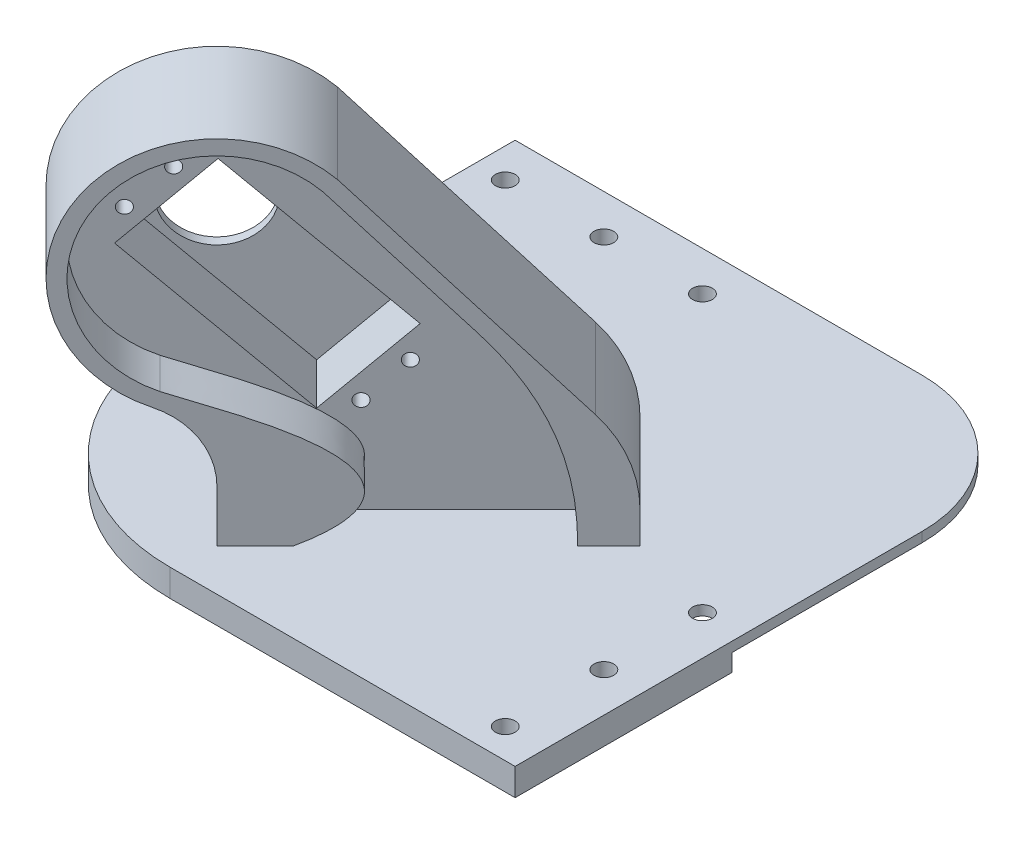
from build123d import *

# Parameters (mm, degrees)
SKETCH2_W                       = 110
SKETCH2_H                       = 110
BOSS_EXTRUDE1_DEPTH             = 5.5
BOSS_EXTRUDE2_DEPTH             = 14
CUT_EXTRUDE5_REACH              = 110.823
SKETCH9_R                       = 1.3
CUT_EXTRUDE6_DEPTH              = 7.5
CUT_EXTRUDE9_REACH              = 109.547
SKETCH11_R                      = 9
BOSS_EXTRUDE7_DEPTH             = 9
BOSS_EXTRUDE7_DIRECTION_2_REACH = 119.904
BOSS_EXTRUDE10_DEPTH            = 9
CUT_EXTRUDE10_DEPTH             = 3.5
F_4_0_4_DIAMETER_HOLE3_D        = 4
FILLET1_R                       = 27.5
FILLET2_R                       = 40


with BuildPart() as part:
    # Sketch2 → Boss-Extrude1 (new body)
    with BuildSketch(Plane(origin=(0, 0, 0), x_dir=(1, 0, 0), z_dir=(0, 1, 0))):
        with Locations((-8.65, 8.65)):
            Rectangle(SKETCH2_W, SKETCH2_H)
    extrude(amount=BOSS_EXTRUDE1_DEPTH)

    # Sketch7 → Boss-Extrude2 (add)
    with BuildSketch(Plane(origin=(-8.65, 0, -8.65), x_dir=(-0.7071067811865479, 0, 0.7071067811865471), z_dir=(-0.7071067811865471, 0, -0.7071067811865479))):
        with BuildLine():
            Line((39.760240188, 5.5), (39.760240188, 15.95953406))
            ThreePointArc((39.760240188, 15.95953406), (42.812638822, 25.987954346), (50.934597235, 32.615181699))
            ThreePointArc((50.934597235, 32.615181699), (60.680796502, 64.420514285), (27.578950135, 67.712223286))
            Line((27.578950135, 67.712223286), (-10.597023433, 29.536249718))
            ThreePointArc((-10.597023433, 29.536249718), (-16.016342216, 21.425665997), (-17.919353903, 11.858580188))
            Line((-17.919353903, 11.858580188), (-17.919353903, 5.5))
            Line((-17.919353903, 5.5), (39.760240188, 5.5))
        make_face()
    extrude(amount=-BOSS_EXTRUDE2_DEPTH)

    # Sketch8 → Cut-Extrude5 (cut, up to next)
    with BuildSketch(Plane(origin=(-7.235786438, 0, -7.235786438), x_dir=(-0.7071067811865479, 0, 0.7071067811865471), z_dir=(-0.7071067811865471, 0, -0.7071067811865479)), mode=Mode.PRIVATE) as cut_extrude5_sk1:
        Polygon((13.613591207, 38.190515171), (42.604969235, 67.1818932), (57.45421164, 52.332650795), (28.462833611, 23.341272767), align=None)
    cut_extrude5_tool1 = extrude(cut_extrude5_sk1.sketch, amount=-CUT_EXTRUDE5_REACH, mode=Mode.PRIVATE) & part.part
    add(cut_extrude5_tool1.solids().sort_by_distance((-32.362049, 45.261583, 17.890476))[0], mode=Mode.SUBTRACT)

    # Sketch9 → Cut-Extrude6 (cut)
    with BuildSketch(Plane(origin=(1.249494937, 0, 1.249494937), x_dir=(0.7071067811865479, 0, -0.7071067811865471), z_dir=(0.7071067811865471, 0, 0.7071067811865479))):
        with Locations((-48.968930266, 65.767679638)):
            Circle(SKETCH9_R)
        with Locations((-56.039998078, 58.696611826)):
            Circle(SKETCH9_R)
        with Locations((-22.098872581, 24.755486329)):
            Circle(SKETCH9_R)
        with Locations((-15.027804769, 31.826554141)):
            Circle(SKETCH9_R)
    extrude(amount=-CUT_EXTRUDE6_DEPTH, mode=Mode.SUBTRACT)

    # Sketch11 → Cut-Extrude9 (cut, up to next)
    with BuildSketch(Plane(origin=(-8.65, 0, -8.65), x_dir=(-0.7071067811865479, 0, 0.7071067811865471), z_dir=(-0.7071067811865471, 0, -0.7071067811865479)), mode=Mode.PRIVATE) as cut_extrude9_sk1:
        with Locations((42.781745931, 52.50942749)):
            Circle(SKETCH11_R)
    cut_extrude9_tool1 = extrude(cut_extrude9_sk1.sketch, amount=-CUT_EXTRUDE9_REACH, mode=Mode.PRIVATE) & part.part
    add(cut_extrude9_tool1.solids().sort_by_distance((-38.901263, 52.509427, 21.601263))[0], mode=Mode.SUBTRACT)

    # Sketch17 → Boss-Extrude7 (add)
    with BuildSketch(Plane(origin=(1.249494937, 0, 1.249494937), x_dir=(0.7071067811865479, 0, -0.7071067811865471), z_dir=(0.7071067811865471, 0, 0.7071067811865479))):
        with BuildLine():
            Line((11.538994713, 28.541175194), (-25.457629791, 69.83354363))
            ThreePointArc((-25.457629791, 69.83354363), (-63.178338442, 66.082526396), (-52.072204394, 29.839240426))
            ThreePointArc((-52.072204394, 29.839240426), (-45.303905717, 24.316550965), (-42.760240188, 15.95953406))
            Line((-42.760240188, 15.95953406), (-42.760240188, 5.5))
            Line((-42.760240188, 5.5), (-39.760240188, 5.5))
            Line((-39.760240188, 5.5), (-39.760240188, 15.95953406))
            ThreePointArc((-39.760240188, 15.95953406), (-42.812638822, 25.987954346), (-50.934597235, 32.615181699))
            ThreePointArc((-50.934597235, 32.615181699), (-60.680796502, 64.420514285), (-27.578950135, 67.712223286))
            Line((-27.578950135, 67.712223286), (9.30583444, 26.537928118))
            ThreePointArc((9.30583444, 26.537928118), (13.46810778, 19.716615191), (14.919353903, 11.858580188))
            Line((14.919353903, 11.858580188), (14.919353903, 5.5))
            Line((14.919353903, 5.5), (17.919353903, 5.5))
            Line((17.919353903, 5.5), (17.919353903, 11.858580188))
            ThreePointArc((17.919353903, 11.858580188), (16.26984662, 20.78911712), (11.538994713, 28.541175194))
        make_face()
    extrude(amount=BOSS_EXTRUDE7_DEPTH)

    # Boss-Extrude7 direction 2: up to this face of the body (flat: up to its plane)
    boss_extrude7_direction_2_end = Plane(part.part.faces().sort_by_distance((-25.67440007, 34.90069961, 8.37440007))[0])
    # Sketch17 → Boss-Extrude7 direction 2 (add, up to the picked face)
    with BuildSketch(Plane(origin=(1.249494937, 0, 1.249494937), x_dir=(0.7071067811865479, 0, -0.7071067811865471), z_dir=(0.7071067811865471, 0, 0.7071067811865479)), mode=Mode.PRIVATE) as boss_extrude7_direction_2_sk1:
        with BuildLine():
            Line((11.538994713, 28.541175194), (-25.457629791, 69.83354363))
            ThreePointArc((-25.457629791, 69.83354363), (-63.178338442, 66.082526396), (-52.072204394, 29.839240426))
            ThreePointArc((-52.072204394, 29.839240426), (-45.303905717, 24.316550965), (-42.760240188, 15.95953406))
            Line((-42.760240188, 15.95953406), (-42.760240188, 5.5))
            Line((-42.760240188, 5.5), (-39.760240188, 5.5))
            Line((-39.760240188, 5.5), (-39.760240188, 15.95953406))
            ThreePointArc((-39.760240188, 15.95953406), (-42.812638822, 25.987954346), (-50.934597235, 32.615181699))
            ThreePointArc((-50.934597235, 32.615181699), (-60.680796502, 64.420514285), (-27.578950135, 67.712223286))
            Line((-27.578950135, 67.712223286), (9.30583444, 26.537928118))
            ThreePointArc((9.30583444, 26.537928118), (13.46810778, 19.716615191), (14.919353903, 11.858580188))
            Line((14.919353903, 11.858580188), (14.919353903, 5.5))
            Line((14.919353903, 5.5), (17.919353903, 5.5))
            Line((17.919353903, 5.5), (17.919353903, 11.858580188))
            ThreePointArc((17.919353903, 11.858580188), (16.26984662, 20.78911712), (11.538994713, 28.541175194))
        make_face()
    boss_extrude7_direction_2_tool1 = split(extrude(boss_extrude7_direction_2_sk1.sketch, amount=-BOSS_EXTRUDE7_DIRECTION_2_REACH, mode=Mode.PRIVATE), bisect_by=boss_extrude7_direction_2_end, keep=Keep.BOTH, mode=Mode.PRIVATE)
    add(boss_extrude7_direction_2_tool1.solids().sort_by(Axis((-4.257288, 48.445096, 6.756277), (-0.7071067811865471, 0, -0.7071067811865479)))[0])

    # Sketch25 → Boss-Extrude10 (add)
    with BuildSketch(Plane(origin=(1.249494937, 0, 1.249494937), x_dir=(0.7071067811865479, 0, -0.7071067811865471), z_dir=(0.7071067811865471, 0, 0.7071067811865479))):
        with BuildLine():
            ThreePointArc((-50.934597235, 32.615181699), (-42.812638822, 25.987954346), (-39.760240188, 15.95953406))
            Line((-39.760240188, 15.95953406), (-39.760240188, 5.5))
            Line((-39.760240188, 5.5), (-31.760240188, 5.5))
            add(Edge.make_bspline(
                [(-50.934597235, 32.615181699), (-42.286107378, 29.070948228), (-3.49892217, 18.530427319), (-31.760240188, 5.5)],
                knots=[0, 0, 0, 0, 1, 1, 1, 1], degree=3))
        make_face()
        with BuildLine():
            add(Edge.make_bspline(
                [(-5.279129206, 42.819047964), (9.40428973, 26.428022984), (8.919353903, 5.5)],
                knots=[0, 0, 0, 1, 1, 1], degree=2))
            Line((8.919353903, 5.5), (14.919353903, 5.5))
            Line((14.919353903, 5.5), (14.919353903, 11.858580188))
            ThreePointArc((14.919353903, 11.858580188), (13.46810778, 19.716615191), (9.30583444, 26.537928118))
            Line((9.30583444, 26.537928118), (-5.279129206, 42.819047964))
        make_face()
    extrude(amount=BOSS_EXTRUDE10_DEPTH)

    # Sketch26 → Cut-Extrude10 (cut)
    with BuildSketch(Plane.XZ):
        with BuildLine():
            Line((-2.35, -23.65), (-2.35, -63.65))
            Line((-2.35, -63.65), (46.35, -63.65))
            Line((46.35, -63.65), (46.35, 2.35))
            Line((46.35, 2.35), (23.65, 2.35))
            ThreePointArc((23.65, 2.35), (5.265223689, -5.265223689), (-2.35, -23.65))
        make_face()
    extrude(amount=-CUT_EXTRUDE10_DEPTH, mode=Mode.SUBTRACT)

    # Ø4.0 (4) Diameter Hole3 (through all)
    with Locations(Plane(origin=(0, 5.5, 0), x_dir=(1, 0, 0), z_dir=(0, 1, 0))):
        with Locations((38.35, -40.35), (38.35, -20.35), (38.35, -0.35)):
            f_4_0_4_diameter_hole3 = Hole(F_4_0_4_DIAMETER_HOLE3_D / 2)

    # Mirror1: Ø4.0 (4) Diameter Hole3 across plane
    add(f_4_0_4_diameter_hole3.mirror(Plane(origin=(-8.65, 0, -8.65), x_dir=(-0.7071067811865481, 0, 0.707106781186547), z_dir=(-0.7071067811865472, 0, -0.707106781186548))), mode=Mode.SUBTRACT)

    # Fillet1
    fillet1_edges = [part.edges().sort_by_distance(p)[0] for p in [
        (46.35, 4.5, -63.65),
    ]]
    fillet(fillet1_edges, radius=FILLET1_R)

    # Fillet2
    fillet2_edges = [part.edges().sort_by_distance(p)[0] for p in [
        (-63.65, 2.75, 46.35),
    ]]
    fillet(fillet2_edges, radius=FILLET2_R)


solid = part.part
